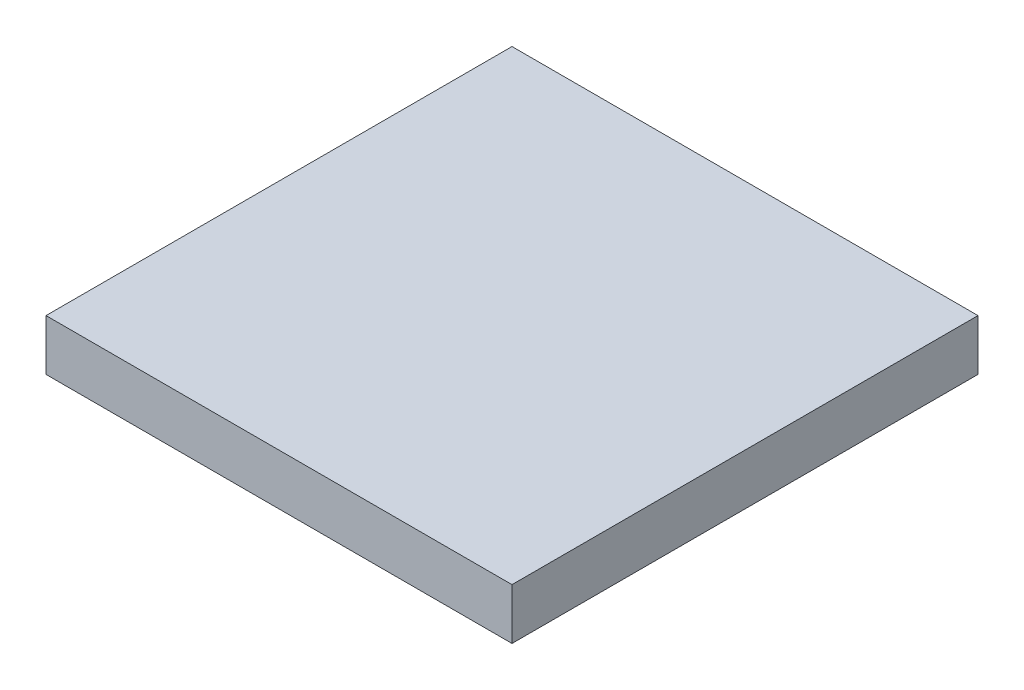
from build123d import *

# Parameters (mm, degrees)
SKETCH3_W           = 101.6
SKETCH3_H           = 11.1125
BOSS_EXTRUDE1_DEPTH = 50.8


with BuildPart() as part:
    # Sketch3 → Boss-Extrude1 (new, symmetric)
    with BuildSketch(Plane.XY):
        Rectangle(SKETCH3_W, SKETCH3_H)
    extrude(amount=BOSS_EXTRUDE1_DEPTH, both=True)


solid = part.part
